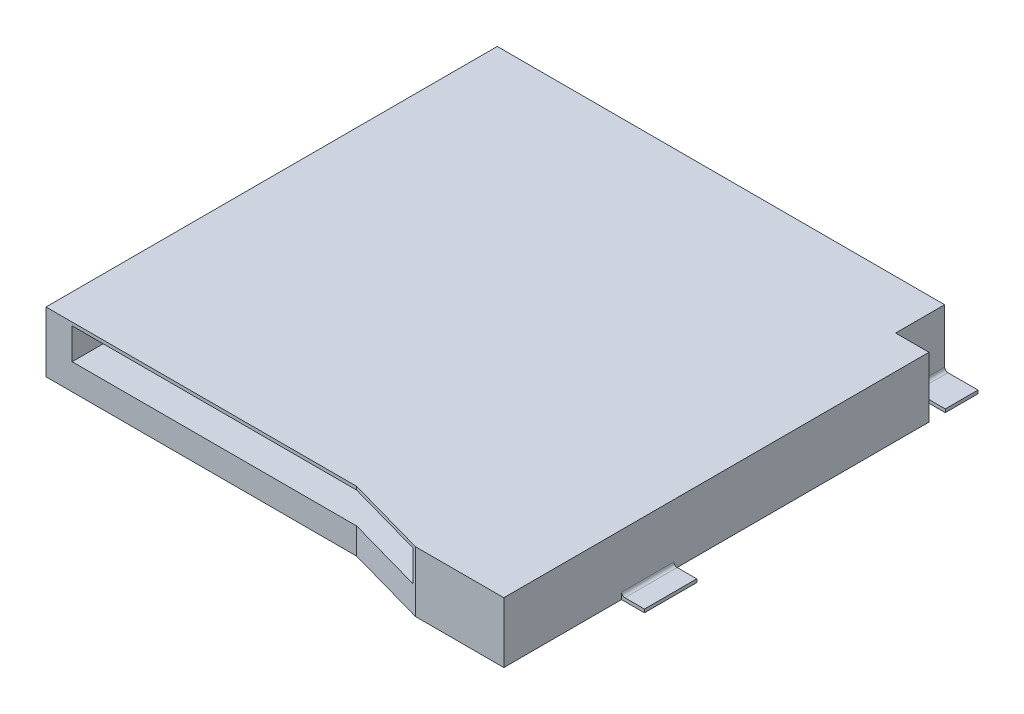
from build123d import *

# Parameters (mm, degrees)
EXTRUDE_1_DEPTH          = 1.85
SKETCH_2_W               = 0.7
SKETCH_2_H               = 1.6
SKETCH_2_W_2             = 1.02
SKETCH_2_H_2             = 1
EXTRUDE_2_DEPTH          = 0.1
SKETCH_3_R               = 0.4
EXTRUDE_3_DEPTH          = 0.6
CUT_EXTRUDE_1_DEPTH      = 12.62835328
CUT_EXTRUDE_1_DEPTH_BACK = 7
SKETCH_4_W               = 11.1
SKETCH_4_H               = 0.95
FILLET_1_R               = 0.1
FILLET_2_R               = 0.1


with BuildPart() as part:
    # 스케치1 → 보스-돌출1 (new body)
    with BuildSketch(Plane(origin=(0, 0, 0), x_dir=(1, 0, 0), z_dir=(0, 1, 0))):
        Polygon((2.66, -6.15), (5.16, -6.85), (7.86, -6.85), (7.86, 6.15), (6.84, 6.15), (6.84, 7.65), (-6.84, 7.65), (-6.84, -6.15), align=None)
    extrude(amount=EXTRUDE_1_DEPTH)

    # 스케치2 → 보스-돌출2 (add)
    with BuildSketch(Plane(origin=(0, 0, 0), x_dir=(1, 0, 0), z_dir=(0, 1, 0))):
        with Locations((8.21, -2.45)):
            Rectangle(SKETCH_2_W, SKETCH_2_H)
        with Locations((7.35, 7.15)):
            Rectangle(SKETCH_2_W_2, SKETCH_2_H_2)
        with Locations((-7.19, 7.15)):
            Rectangle(SKETCH_2_W, SKETCH_2_H_2)
        with Locations((-7.19, -2.45)):
            Rectangle(SKETCH_2_W, SKETCH_2_H)
    extrude(amount=EXTRUDE_2_DEPTH)

    # 스케치3 → 보스-돌출3 (add)
    with BuildSketch(Plane.XZ):
        with Locations(Location((-4.95, 2.85, 0), (0, 0, 90))):
            Circle(SKETCH_3_R)
        with Locations(Location((3.05, 2.85, 0), (0, 0, 90))):
            Circle(SKETCH_3_R)
    extrude(amount=EXTRUDE_3_DEPTH)

    # 스케치4 → 컷-돌출1 (cut, two sides: drawn at the far end of the back side and taken through both)
    with BuildSketch(Plane.XY.offset(-CUT_EXTRUDE_1_DEPTH_BACK)):
        with Locations((-0.49, 1.275)):
            Rectangle(SKETCH_4_W, SKETCH_4_H)
    extrude(amount=CUT_EXTRUDE_1_DEPTH + CUT_EXTRUDE_1_DEPTH_BACK, mode=Mode.SUBTRACT)

    # 필렛1
    fillet_1_edges = [part.edges().sort_by_distance(p)[0] for p in [
        (-4.95, -0.6, 2.45),
        (3.05, -0.6, 2.45),
    ]]
    fillet(fillet_1_edges, radius=FILLET_1_R)

    # 필렛2
    fillet_2_edges = [part.edges().sort_by_distance(p)[0] for p in [
        (6.84, 0.1, -7.15),
        (7.86, 0.1, 2.45),
        (-6.84, 0.1, -7.15),
        (-6.84, 0.1, 2.45),
    ]]
    fillet(fillet_2_edges, radius=FILLET_2_R)


solid = part.part
